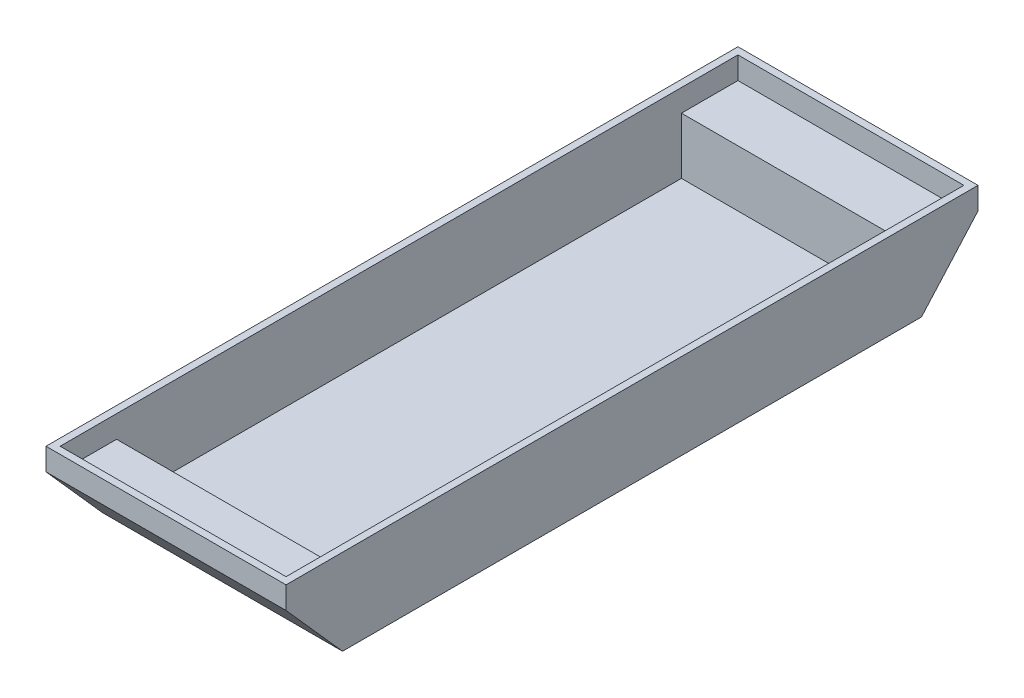
from build123d import *

# Parameters (mm, degrees)
BOSS_EXTRUDE1_DEPTH = 26.9875
BOSS_EXTRUDE2_DEPTH = 1.5875


with BuildPart() as part:
    # Sketch3 → Boss-Extrude1 (new, symmetric)
    with BuildSketch(Plane(origin=(0, 0, 0), x_dir=(0, 0, -1), z_dir=(1, 0, 0))):
        Polygon((95.5744504, 32.516625584), (108.2744504, 46.804125584), (108.2744504, 51.804125584), (106.6869504, 51.804125584), (106.6869504, 46.804125584), (93.9869504, 46.804125584), (93.9869504, 34.104125584), (-33.0130496, 34.104125584), (-33.0130496, 46.804125584), (-45.7130496, 46.804125584), (-45.7130496, 51.804125584), (-47.3005496, 51.804125584), (-47.3005496, 46.804125584), (-34.6005496, 32.516625584), align=None)
    extrude(amount=BOSS_EXTRUDE1_DEPTH, both=True)

    # Sketch4 → Boss-Extrude2 (add)
    with BuildSketch(Plane(origin=(26.9875, 0, 0), x_dir=(0, 0, -1), z_dir=(1, 0, 0))):
        Polygon((-33.0130496, 46.804125584), (-33.0130496, 34.104125584), (93.9869504, 34.104125584), (93.9869504, 46.804125584), (108.2744504, 46.804125584), (108.2744504, 51.804125584), (-47.3005496, 51.804125584), (-47.3005496, 46.804125584), align=None)
    boss_extrude2 = extrude(amount=-BOSS_EXTRUDE2_DEPTH)

    # Mirror1: Boss-Extrude2 across plane
    add(boss_extrude2.mirror(Plane(origin=(0, 0, 0), x_dir=(0, 0, 1), z_dir=(1, 0, 0))))


solid = part.part
